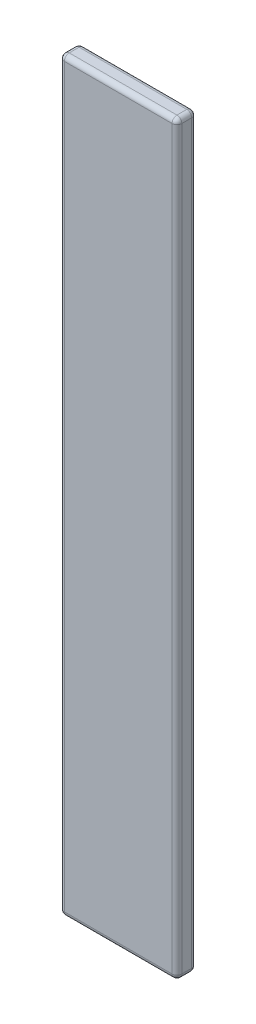
from build123d import *

# Parameters (mm, degrees)
SKETCH1_W           = 48
SKETCH1_H           = 305
BOSS_EXTRUDE1_DEPTH = 8
FILLET1_R           = 2


with BuildPart() as part:
    # Sketch1 → Boss-Extrude1 (new body)
    with BuildSketch(Plane.XY):
        Rectangle(SKETCH1_W, SKETCH1_H)
    extrude(amount=BOSS_EXTRUDE1_DEPTH)

    # Fillet1
    fillet1_edges = [part.edges().sort_by_distance(p)[0] for p in [
        (-24, 0, 8),
        (0, -152.5, 8),
        (24, 0, 8),
        (0, -152.5, 0),
        (-24, 0, 0),
        (0, 152.5, 0),
        (24, 0, 0),
        (0, 152.5, 8),
        (24, -152.5, 4),
        (-24, -152.5, 4),
        (-24, 152.5, 4),
        (24, 152.5, 4),
    ]]
    fillet(fillet1_edges, radius=FILLET1_R)


solid = part.part
